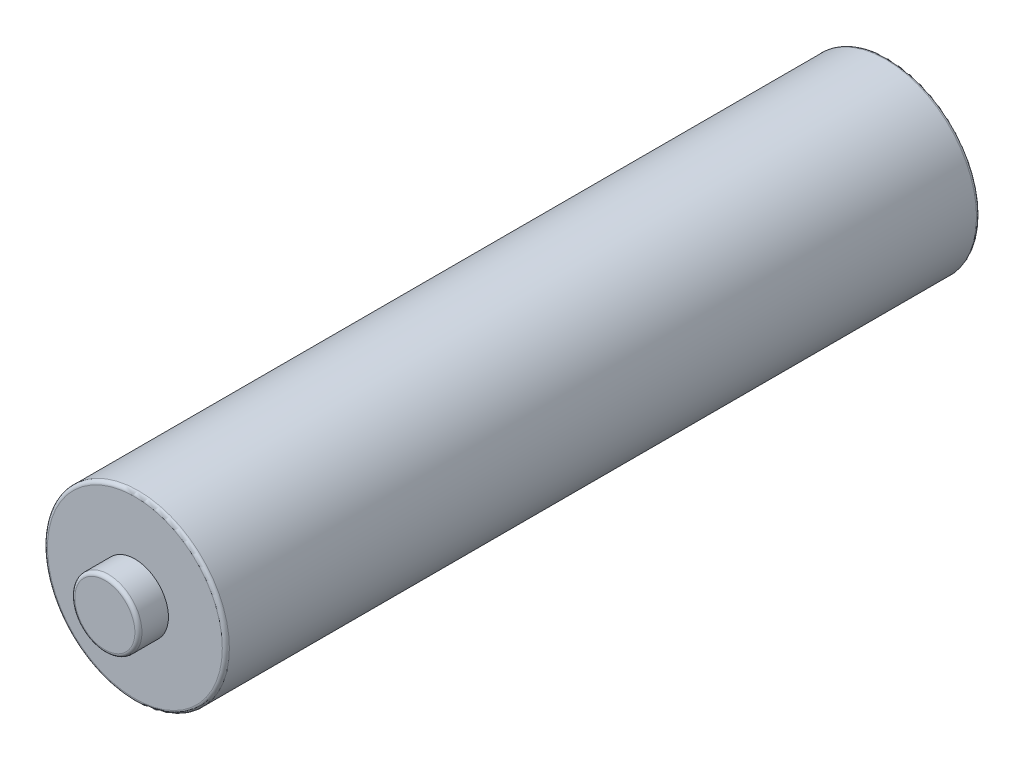
from build123d import *

# Parameters (mm, degrees)
SKICA1_R                = 5.15
P_IDAT_VYSUNUT_M1_DEPTH = 42.7
SKICA2_R                = 1.9
P_IDAT_VYSUNUT_M2_DEPTH = 1.7
ZAOBLIT1_R              = 0.2
ZAOBLIT2_R              = 0.2


with BuildPart() as part:
    # Skica1 → Přidat vysunutím1 (new body)
    with BuildSketch(Plane.XY):
        with Locations(Location((0, 0, 0), (0, 0, 180))):
            Circle(SKICA1_R)
    extrude(amount=P_IDAT_VYSUNUT_M1_DEPTH)

    # Skica2 → Přidat vysunutím2 (add)
    with BuildSketch(Plane.XY.offset(42.7)):
        Circle(SKICA2_R)
    extrude(amount=P_IDAT_VYSUNUT_M2_DEPTH)

    # Zaoblit1
    zaoblit1_edges = [part.edges().sort_by_distance(p)[0] for p in [
        (-1.9, 0, 44.4),
    ]]
    fillet(zaoblit1_edges, radius=ZAOBLIT1_R)

    # Zaoblit2
    zaoblit2_edges = [part.edges().sort_by_distance(p)[0] for p in [
        (5.15, 0, 0),
        (5.15, 0, 42.7),
    ]]
    fillet(zaoblit2_edges, radius=ZAOBLIT2_R)


solid = part.part
